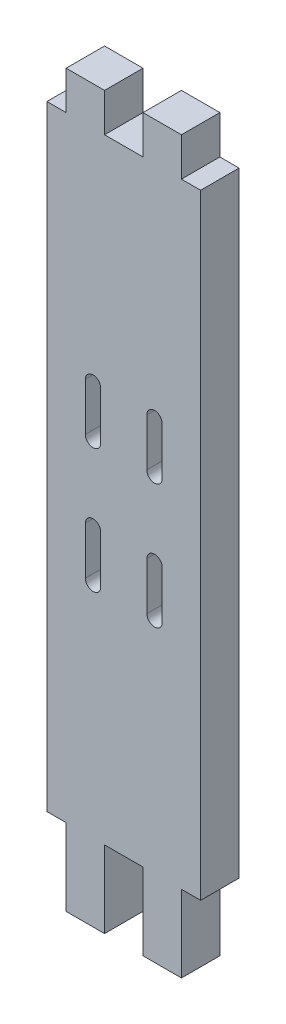
from build123d import *

# Parameters (mm, degrees)
BOSS_EXTRUDE1_DEPTH = 5


with BuildPart() as part:
    # Sketch1 → Boss-Extrude1 (new body)
    with BuildSketch(Plane.XY):
        Polygon((-7.5, 40), (-7.5, 45), (-2.5, 45), (-2.5, 40), (2.5, 40), (2.5, 45), (7.5, 45), (7.5, 40), (10, 40), (10, -40), (7.5, -40), (7.5, -50), (2.5, -50), (2.5, -45), (2.5, -40), (-2.5, -40), (-2.5, -50), (-7.5, -50), (-7.5, -45), (-7.5, -40), (-10, -40), (-10, 40), align=None)
        with BuildLine():
            Line((3, -11.2), (3, -5))
            ThreePointArc((3, -5), (4, -4), (5, -5))
            Line((5, -5), (5, -11.2))
            ThreePointArc((5, -11.2), (4, -12.2), (3, -11.2))
        make_face(mode=Mode.SUBTRACT)
        with BuildLine():
            Line((3, 11.2), (3, 5))
            ThreePointArc((3, 5), (4, 4), (5, 5))
            Line((5, 5), (5, 11.2))
            ThreePointArc((5, 11.2), (4, 12.2), (3, 11.2))
        make_face(mode=Mode.SUBTRACT)
        with BuildLine():
            Line((-3, 11.2), (-3, 5))
            ThreePointArc((-3, 5), (-4, 4), (-5, 5))
            Line((-5, 5), (-5, 11.2))
            ThreePointArc((-5, 11.2), (-4, 12.2), (-3, 11.2))
        make_face(mode=Mode.SUBTRACT)
        with BuildLine():
            Line((-3, -11.2), (-3, -5))
            ThreePointArc((-3, -5), (-4, -4), (-5, -5))
            Line((-5, -5), (-5, -11.2))
            ThreePointArc((-5, -11.2), (-4, -12.2), (-3, -11.2))
        make_face(mode=Mode.SUBTRACT)
    extrude(amount=BOSS_EXTRUDE1_DEPTH)


solid = part.part
